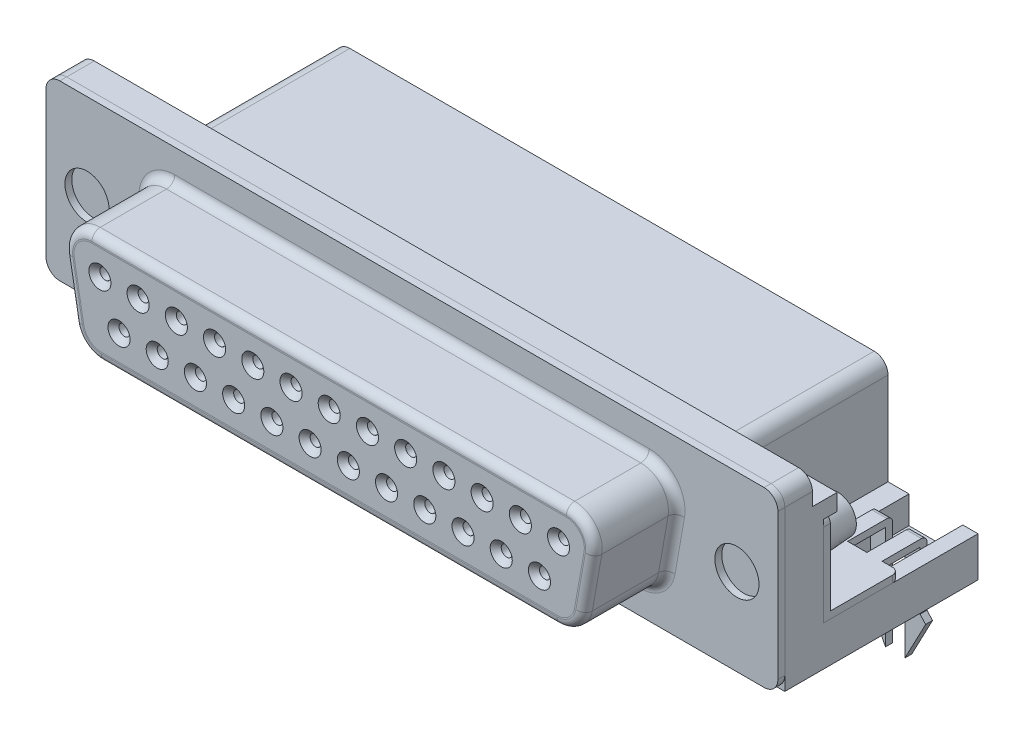
from build123d import *

# Parameters (mm, degrees)
EXTRUIR1_DEPTH         = 0.5
EXTRUIR2_DEPTH         = 6
CORTAR_EXTRUIR1_DEPTH  = 6
REDONDEO1_R            = 0.6
CROQUIS5_R             = 0.4
EXTRUIR3_DEPTH         = 6
CHAFL_N1_SIZE          = 0.4
CROQUIS6_R             = 1.6
CORTAR_EXTRUIR2_DEPTH  = 6
EXTRUIR5_DEPTH         = 14
CORTAR_EXTRUIR4_DEPTH  = 12
REDONDEO2_R            = 1
EXTRUIR6_DEPTH         = 53.04
CROQUIS13_W            = 3.9
CROQUIS13_H            = 13.996987952
CORTAR_EXTRUIR5_DEPTH  = 2
CROQUIS14_W            = 39.5
CROQUIS14_H            = 13.668273092
CORTAR_EXTRUIR6_DEPTH  = 0.6
EXTRUIR7_DEPTH         = 4.4
EXTRUIR7_DEPTH_BACK    = 2
CROQUIS15_W            = 0.7
CROQUIS15_H            = 0.7
EXTRUIR7_2_DEPTH       = 4.4
EXTRUIR7_2_DEPTH_BACK  = 2
EXTRUIR7_3_DEPTH       = 4.4
EXTRUIR7_3_DEPTH_BACK  = 2
EXTRUIR7_4_DEPTH       = 4.4
EXTRUIR7_4_DEPTH_BACK  = 2
EXTRUIR7_5_DEPTH       = 4.4
EXTRUIR7_5_DEPTH_BACK  = 2
EXTRUIR7_6_DEPTH       = 4.4
EXTRUIR7_6_DEPTH_BACK  = 2
EXTRUIR7_7_DEPTH       = 4.4
EXTRUIR7_7_DEPTH_BACK  = 2
EXTRUIR7_8_DEPTH       = 4.4
EXTRUIR7_8_DEPTH_BACK  = 2
EXTRUIR7_9_DEPTH       = 4.4
EXTRUIR7_9_DEPTH_BACK  = 2
EXTRUIR7_10_DEPTH      = 4.4
EXTRUIR7_10_DEPTH_BACK = 2
EXTRUIR7_11_DEPTH      = 4.4
EXTRUIR7_11_DEPTH_BACK = 2
EXTRUIR7_12_DEPTH      = 4.4
EXTRUIR7_12_DEPTH_BACK = 2
EXTRUIR7_13_DEPTH      = 4.4
EXTRUIR7_13_DEPTH_BACK = 2
EXTRUIR7_14_DEPTH      = 4.4
EXTRUIR7_14_DEPTH_BACK = 2
EXTRUIR7_15_DEPTH      = 4.4
EXTRUIR7_15_DEPTH_BACK = 2
EXTRUIR7_16_DEPTH      = 4.4
EXTRUIR7_16_DEPTH_BACK = 2
EXTRUIR7_17_DEPTH      = 4.4
EXTRUIR7_17_DEPTH_BACK = 2
EXTRUIR7_18_DEPTH      = 4.4
EXTRUIR7_18_DEPTH_BACK = 2
EXTRUIR7_19_DEPTH      = 4.4
EXTRUIR7_19_DEPTH_BACK = 2
EXTRUIR7_20_DEPTH      = 4.4
EXTRUIR7_20_DEPTH_BACK = 2
EXTRUIR7_21_DEPTH      = 4.4
EXTRUIR7_21_DEPTH_BACK = 2
EXTRUIR7_22_DEPTH      = 4.4
EXTRUIR7_22_DEPTH_BACK = 2
EXTRUIR7_23_DEPTH      = 4.4
EXTRUIR7_23_DEPTH_BACK = 2
EXTRUIR7_24_DEPTH      = 4.4
EXTRUIR7_24_DEPTH_BACK = 2
EXTRUIR7_25_DEPTH      = 4.4
EXTRUIR7_25_DEPTH_BACK = 2
CROQUIS16_W            = 0.7
CROQUIS16_H            = 4.035508996
CROQUIS16_H_2          = 6.875508996
CORTAR_EXTRUIR7_DEPTH  = 2
CORTAR_EXTRUIR9_DEPTH  = 4
EXTRUIR8_DEPTH         = 0.5
CROQUIS19_W            = 1.1
CROQUIS19_H            = 3.25
EXTRUIR9_DEPTH         = 0.5
REDONDEO3_R            = 0.4
EXTRUIR10_DEPTH        = 0.5
EXTRUIR10_2_DEPTH      = 0.5
REDONDEO4_R            = 0.4
CROQUIS21_R            = 1.6
EXTRUIR11_DEPTH        = 3.5
EXTRUIR11_TAPER        = 4
CROQUIS22_W            = 37
CROQUIS22_H            = 6
CROQUIS22_W_2          = 36.8
CROQUIS22_H_2          = 5.8
CORTAR_EXTRUIR10_DEPTH = 6.5


with BuildPart() as part:
    # Croquis1 → Extruir1 (new body)
    with BuildSketch(Plane.XY):
        with BuildLine():
            Line((-25.52, 6.275), (25.52, 6.275))
            ThreePointArc((25.52, 6.275), (26.227106781, 5.982106781), (26.52, 5.275))
            Line((26.52, 5.275), (26.52, -5.275))
            ThreePointArc((26.52, -5.275), (26.227106781, -5.982106781), (25.52, -6.275))
            Line((25.52, -6.275), (-25.52, -6.275))
            ThreePointArc((-25.52, -6.275), (-26.227106781, -5.982106781), (-26.52, -5.275))
            Line((-26.52, -5.275), (-26.52, 5.275))
            ThreePointArc((-26.52, 5.275), (-26.227106781, 5.982106781), (-25.52, 6.275))
        make_face()
    extrude(amount=EXTRUIR1_DEPTH)

    # Croquis2 → Extruir2 (add)
    with BuildSketch(Plane.XY.offset(0.5)):
        with BuildLine():
            Line((19.159615506, 1.602703645), (18.471940281, -2.297296355))
            ThreePointArc((18.471940281, -2.297296355), (17.787899995, -3.482088886), (16.502324775, -3.95))
            Line((16.502324775, -3.95), (-16.502324775, -3.95))
            ThreePointArc((-16.502324775, -3.95), (-17.787899995, -3.482088886), (-18.471940281, -2.297296355))
            Line((-18.471940281, -2.297296355), (-19.159615506, 1.602703645))
            ThreePointArc((-19.159615506, 1.602703645), (-18.722088886, 3.235575219), (-17.19, 3.95))
            Line((-17.19, 3.95), (17.19, 3.95))
            ThreePointArc((17.19, 3.95), (18.722088886, 3.235575219), (19.159615506, 1.602703645))
        make_face()
    extrude(amount=EXTRUIR2_DEPTH)

    # Croquis3 → Cortar-Extruir1 (cut)
    with BuildSketch(Plane.XY.offset(6.5)):
        with BuildLine():
            Line((17.19, 3.25), (-17.19, 3.25))
            ThreePointArc((-17.19, 3.25), (-18.185857776, 2.785623893), (-18.470250079, 1.724257369))
            Line((-18.470250079, 1.724257369), (-17.782574854, -2.175742631))
            ThreePointArc((-17.782574854, -2.175742631), (-17.337948668, -2.945857776), (-16.502324775, -3.25))
            Line((-16.502324775, -3.25), (16.502324775, -3.25))
            ThreePointArc((16.502324775, -3.25), (17.337948668, -2.945857776), (17.782574854, -2.175742631))
            Line((17.782574854, -2.175742631), (18.470250079, 1.724257369))
            ThreePointArc((18.470250079, 1.724257369), (18.185857776, 2.785623893), (17.19, 3.25))
        make_face()
    extrude(amount=-CORTAR_EXTRUIR1_DEPTH, mode=Mode.SUBTRACT)

    # Redondeo1
    redondeo1_edges = [part.edges().sort_by_distance(p)[0] for p in [
        (17.787899995, -3.482088886, 0.5),
        (18.815777894, -0.347296355, 0.5),
        (18.722088886, 3.235575219, 0.5),
        (0, 3.95, 0.5),
        (-18.722088886, 3.235575219, 0.5),
        (-18.815777894, -0.347296355, 0.5),
        (-17.787899995, -3.482088886, 0.5),
        (0, -3.95, 0.5),
        (17.787899995, -3.482088886, 6.5),
        (18.815777894, -0.347296355, 6.5),
        (18.722088886, 3.235575219, 6.5),
        (0, 3.95, 6.5),
        (-18.722088886, 3.235575219, 6.5),
        (-18.815777894, -0.347296355, 6.5),
        (-17.787899995, -3.482088886, 6.5),
        (0, -3.95, 6.5),
    ]]
    fillet(redondeo1_edges, radius=REDONDEO1_R)

    # Croquis6 → Cortar-Extruir2 (cut)
    with BuildSketch(Plane.XY.offset(0.5)):
        with Locations((23.55, 0)):
            Circle(CROQUIS6_R)
        with Locations((-23.55, 0)):
            Circle(CROQUIS6_R)
    extrude(amount=-CORTAR_EXTRUIR2_DEPTH, mode=Mode.SUBTRACT)


with BuildPart() as body_2:
    # Croquis5 → Extruir3 (new body)
    with BuildSketch(Plane.XY.offset(0.5)):
        with BuildLine():
            Line((17.19, 3.25), (-17.19, 3.25))
            ThreePointArc((-17.19, 3.25), (-18.185857776, 2.785623893), (-18.470250079, 1.724257369))
            Line((-18.470250079, 1.724257369), (-17.782574854, -2.175742631))
            ThreePointArc((-17.782574854, -2.175742631), (-17.337948668, -2.945857776), (-16.502324775, -3.25))
            Line((-16.502324775, -3.25), (16.502324775, -3.25))
            ThreePointArc((16.502324775, -3.25), (17.337948668, -2.945857776), (17.782574854, -2.175742631))
            Line((17.782574854, -2.175742631), (18.470250079, 1.724257369))
            ThreePointArc((18.470250079, 1.724257369), (18.185857776, 2.785623893), (17.19, 3.25))
        make_face()
        with Locations((16.625, 1.42)):
            Circle(CROQUIS5_R, mode=Mode.SUBTRACT)
        with Locations((13.855, 1.42)):
            Circle(CROQUIS5_R, mode=Mode.SUBTRACT)
        with Locations((11.085, 1.42)):
            Circle(CROQUIS5_R, mode=Mode.SUBTRACT)
        with Locations((8.315, 1.42)):
            Circle(CROQUIS5_R, mode=Mode.SUBTRACT)
        with Locations((5.545, 1.42)):
            Circle(CROQUIS5_R, mode=Mode.SUBTRACT)
        with Locations((2.775, 1.42)):
            Circle(CROQUIS5_R, mode=Mode.SUBTRACT)
        with Locations((0.005, 1.42)):
            Circle(CROQUIS5_R, mode=Mode.SUBTRACT)
        with Locations((-2.765, 1.42)):
            Circle(CROQUIS5_R, mode=Mode.SUBTRACT)
        with Locations((-5.535, 1.42)):
            Circle(CROQUIS5_R, mode=Mode.SUBTRACT)
        with Locations((-8.305, 1.42)):
            Circle(CROQUIS5_R, mode=Mode.SUBTRACT)
        with Locations((-11.075, 1.42)):
            Circle(CROQUIS5_R, mode=Mode.SUBTRACT)
        with Locations((-13.845, 1.42)):
            Circle(CROQUIS5_R, mode=Mode.SUBTRACT)
        with Locations((-16.615, 1.42)):
            Circle(CROQUIS5_R, mode=Mode.SUBTRACT)
        with Locations((15.24, -1.42)):
            Circle(CROQUIS5_R, mode=Mode.SUBTRACT)
        with Locations((12.47, -1.42)):
            Circle(CROQUIS5_R, mode=Mode.SUBTRACT)
        with Locations((9.7, -1.42)):
            Circle(CROQUIS5_R, mode=Mode.SUBTRACT)
        with Locations((6.93, -1.42)):
            Circle(CROQUIS5_R, mode=Mode.SUBTRACT)
        with Locations((4.16, -1.42)):
            Circle(CROQUIS5_R, mode=Mode.SUBTRACT)
        with Locations((1.39, -1.42)):
            Circle(CROQUIS5_R, mode=Mode.SUBTRACT)
        with Locations((-1.38, -1.42)):
            Circle(CROQUIS5_R, mode=Mode.SUBTRACT)
        with Locations((-4.15, -1.42)):
            Circle(CROQUIS5_R, mode=Mode.SUBTRACT)
        with Locations((-6.92, -1.42)):
            Circle(CROQUIS5_R, mode=Mode.SUBTRACT)
        with Locations((-9.69, -1.42)):
            Circle(CROQUIS5_R, mode=Mode.SUBTRACT)
        with Locations((-12.46, -1.42)):
            Circle(CROQUIS5_R, mode=Mode.SUBTRACT)
        with Locations((-15.23, -1.42)):
            Circle(CROQUIS5_R, mode=Mode.SUBTRACT)
    extrude(amount=EXTRUIR3_DEPTH)

    # Chaflán1
    chafl_n1_edges = [body_2.edges().sort_by_distance(p)[0] for p in [
        (-7.32, -1.42, 6.5),
        (-10.09, -1.42, 6.5),
        (-12.86, -1.42, 6.5),
        (-15.63, -1.42, 6.5),
        (16.225, 1.42, 6.5),
        (13.455, 1.42, 6.5),
        (10.685, 1.42, 6.5),
        (7.915, 1.42, 6.5),
        (5.145, 1.42, 6.5),
        (2.375, 1.42, 6.5),
        (-0.395, 1.42, 6.5),
        (-3.165, 1.42, 6.5),
        (-5.935, 1.42, 6.5),
        (-8.705, 1.42, 6.5),
        (-11.475, 1.42, 6.5),
        (-14.245, 1.42, 6.5),
        (-17.015, 1.42, 6.5),
        (14.84, -1.42, 6.5),
        (12.07, -1.42, 6.5),
        (9.3, -1.42, 6.5),
        (6.53, -1.42, 6.5),
        (3.76, -1.42, 6.5),
        (0.99, -1.42, 6.5),
        (-1.78, -1.42, 6.5),
        (-4.55, -1.42, 6.5),
    ]]
    chamfer(chafl_n1_edges, length=CHAFL_N1_SIZE)


with BuildPart() as body_3:
    # Croquis10 → Extruir5 (new body)
    with BuildSketch(Plane(origin=(0, 0, 0), x_dir=(-1, 0, 0), z_dir=(0, 0, -1))):
        with BuildLine():
            Line((-25.52, 6.275), (25.52, 6.275))
            ThreePointArc((25.52, 6.275), (26.227106781, 5.982106781), (26.52, 5.275))
            Line((26.52, 5.275), (26.52, -6.275))
            Line((26.52, -6.275), (-26.52, -6.275))
            Line((-26.52, -6.275), (-26.52, 5.275))
            ThreePointArc((-26.52, 5.275), (-26.227106781, 5.982106781), (-25.52, 6.275))
        make_face()
    extrude(amount=EXTRUIR5_DEPTH)

    # Croquis11 → Cortar-Extruir4 (cut)
    with BuildSketch(Plane(origin=(0, 0, -14), x_dir=(-1, 0, 0), z_dir=(0, 0, -1))):
        Polygon((30.029317269, -3.375), (20, -3.375), (20, 4.325), (-20, 4.325), (-20, -3.375), (-30.65060241, -3.375), (-30.65060241, 10.825803213), (30.029317269, 10.825803213), align=None)
    extrude(amount=-CORTAR_EXTRUIR4_DEPTH, mode=Mode.SUBTRACT)

    # Redondeo2
    redondeo2_edges = [body_3.edges().sort_by_distance(p)[0] for p in [
        (-20, 4.325, -8),
        (20, 4.325, -8),
    ]]
    fillet(redondeo2_edges, radius=REDONDEO2_R)


with BuildPart() as body_4:
    # Croquis12 → Extruir6 (new body)
    with BuildSketch(Plane(origin=(26.52, 0, 0), x_dir=(0, 0, -1), z_dir=(1, 0, 0))):
        Polygon((2, 4.325), (3.8, 4.325), (3.8, 3.125), (2.8, 3.125), (2.8, -3.375), (2, -3.375), align=None)
    extrude(amount=-EXTRUIR6_DEPTH)


with BuildPart() as body_3_1:
    add(body_3.part)

    # Combinar1: union body 4
    add(body_4.part)

    # Croquis13 → Cortar-Extruir5 (cut)
    with BuildSketch(Plane(origin=(0, -3.375, 0), x_dir=(-1, 0, 0), z_dir=(0, 1, 0))):
        with Locations((-23.47, -9.798493976)):
            Rectangle(CROQUIS13_W, CROQUIS13_H)
        with Locations((23.47, -9.798493976)):
            Rectangle(CROQUIS13_W, CROQUIS13_H)
    extrude(amount=-CORTAR_EXTRUIR5_DEPTH, mode=Mode.SUBTRACT)

    # Croquis14 → Cortar-Extruir6 (cut)
    with BuildSketch(Plane.XZ.offset(6.275)):
        with Locations((0, -8.834136546)):
            Rectangle(CROQUIS14_W, CROQUIS14_H)
    extrude(amount=-CORTAR_EXTRUIR6_DEPTH, mode=Mode.SUBTRACT)

    # Croquis16 → Cortar-Extruir7 (cut)
    with BuildSketch(Plane.XZ.offset(5.675)):
        with Locations((16.625, -14.017754498)):
            Rectangle(CROQUIS16_W, CROQUIS16_H)
        with Locations((13.855, -14.017754498)):
            Rectangle(CROQUIS16_W, CROQUIS16_H)
        with Locations((15.24, -12.597754498)):
            Rectangle(CROQUIS16_W, CROQUIS16_H_2)
        with Locations((12.47, -12.597754498)):
            Rectangle(CROQUIS16_W, CROQUIS16_H_2)
        with Locations((11.085, -14.017754498)):
            Rectangle(CROQUIS16_W, CROQUIS16_H)
        with Locations((9.7, -12.597754498)):
            Rectangle(CROQUIS16_W, CROQUIS16_H_2)
        with Locations((8.315, -14.017754498)):
            Rectangle(CROQUIS16_W, CROQUIS16_H)
        with Locations((6.93, -12.597754498)):
            Rectangle(CROQUIS16_W, CROQUIS16_H_2)
        with Locations((5.545, -14.017754498)):
            Rectangle(CROQUIS16_W, CROQUIS16_H)
        with Locations((4.16, -12.597754498)):
            Rectangle(CROQUIS16_W, CROQUIS16_H_2)
        with Locations((2.775, -14.017754498)):
            Rectangle(CROQUIS16_W, CROQUIS16_H)
        with Locations((1.39, -12.597754498)):
            Rectangle(CROQUIS16_W, CROQUIS16_H_2)
        with Locations((0.005, -14.017754498)):
            Rectangle(CROQUIS16_W, CROQUIS16_H)
        with Locations((-1.38, -12.597754498)):
            Rectangle(CROQUIS16_W, CROQUIS16_H_2)
        with Locations((-2.765, -14.017754498)):
            Rectangle(CROQUIS16_W, CROQUIS16_H)
        with Locations((-4.15, -12.597754498)):
            Rectangle(CROQUIS16_W, CROQUIS16_H_2)
        with Locations((-5.535, -14.017754498)):
            Rectangle(CROQUIS16_W, CROQUIS16_H)
        with Locations((-6.92, -12.597754498)):
            Rectangle(CROQUIS16_W, CROQUIS16_H_2)
        with Locations((-8.305, -14.017754498)):
            Rectangle(CROQUIS16_W, CROQUIS16_H)
        with Locations((-9.69, -12.597754498)):
            Rectangle(CROQUIS16_W, CROQUIS16_H_2)
        with Locations((-11.075, -14.017754498)):
            Rectangle(CROQUIS16_W, CROQUIS16_H)
        with Locations((-12.46, -12.597754498)):
            Rectangle(CROQUIS16_W, CROQUIS16_H_2)
        with Locations((-13.845, -14.017754498)):
            Rectangle(CROQUIS16_W, CROQUIS16_H)
        with Locations((-15.23, -12.597754498)):
            Rectangle(CROQUIS16_W, CROQUIS16_H_2)
        with Locations((-16.615, -14.017754498)):
            Rectangle(CROQUIS16_W, CROQUIS16_H)
    extrude(amount=-CORTAR_EXTRUIR7_DEPTH, mode=Mode.SUBTRACT)

    # Croquis17 → Cortar-Extruir9 (cut)
    with BuildSketch(Plane(origin=(0, -5.375, 0), x_dir=(-1, 0, 0), z_dir=(0, 1, 0))):
        with BuildLine():
            Line((-21.52, -9.3), (-21.52, -11.3))
            ThreePointArc((-21.52, -11.3), (-23.47, -13.25), (-25.42, -11.3))
            Line((-25.42, -11.3), (-25.42, -9.3))
            ThreePointArc((-25.42, -9.3), (-23.47, -7.35), (-21.52, -9.3))
        make_face()
        with BuildLine():
            Line((25.42, -9.3), (25.42, -11.3))
            ThreePointArc((25.42, -11.3), (23.47, -13.25), (21.52, -11.3))
            Line((21.52, -11.3), (21.52, -9.3))
            ThreePointArc((21.52, -9.3), (23.47, -7.35), (25.42, -9.3))
        make_face()
    extrude(amount=-CORTAR_EXTRUIR9_DEPTH, mode=Mode.SUBTRACT)

    # Redondeo3
    redondeo3_edges = [body_3_1.edges().sort_by_distance(p)[0] for p in [
        (25.97, -3.375, -2.8),
    ]]
    fillet(redondeo3_edges, radius=REDONDEO3_R)

    # Croquis22 → Cortar-Extruir10 (cut)
    with BuildSketch(Plane(origin=(0, 0, -14), x_dir=(-1, 0, 0), z_dir=(0, 0, -1))):
        with Locations((0, -0.675)):
            Rectangle(CROQUIS22_W, CROQUIS22_H)
        with Locations((0, -0.675)):
            Rectangle(CROQUIS22_W_2, CROQUIS22_H_2, mode=Mode.SUBTRACT)
    extrude(amount=-CORTAR_EXTRUIR10_DEPTH, mode=Mode.SUBTRACT)


with BuildPart() as body_4_2:
    # Croquis15 → Extruir7 (new, two sides: drawn at the far end of the back side and taken through both)
    with BuildSketch(Plane.XZ.offset(5.675).offset(-EXTRUIR7_DEPTH_BACK)):
        with Locations((16.625, -12.35)):
            Rectangle(CROQUIS15_W, CROQUIS15_H)
    extrude(amount=EXTRUIR7_DEPTH + EXTRUIR7_DEPTH_BACK)


with BuildPart() as body_5:
    # Croquis15 → Extruir7 2 (new, two sides: drawn at the far end of the back side and taken through both)
    with BuildSketch(Plane.XZ.offset(5.675).offset(-EXTRUIR7_2_DEPTH_BACK)):
        with Locations((13.855, -12.35)):
            Rectangle(CROQUIS15_W, CROQUIS15_H)
    extrude(amount=EXTRUIR7_2_DEPTH + EXTRUIR7_2_DEPTH_BACK)


with BuildPart() as body_6:
    # Croquis15 → Extruir7 3 (new, two sides: drawn at the far end of the back side and taken through both)
    with BuildSketch(Plane.XZ.offset(5.675).offset(-EXTRUIR7_3_DEPTH_BACK)):
        with Locations((11.085, -12.35)):
            Rectangle(CROQUIS15_W, CROQUIS15_H)
    extrude(amount=EXTRUIR7_3_DEPTH + EXTRUIR7_3_DEPTH_BACK)


with BuildPart() as body_7:
    # Croquis15 → Extruir7 4 (new, two sides: drawn at the far end of the back side and taken through both)
    with BuildSketch(Plane.XZ.offset(5.675).offset(-EXTRUIR7_4_DEPTH_BACK)):
        with Locations((8.315, -12.35)):
            Rectangle(CROQUIS15_W, CROQUIS15_H)
    extrude(amount=EXTRUIR7_4_DEPTH + EXTRUIR7_4_DEPTH_BACK)


with BuildPart() as body_8:
    # Croquis15 → Extruir7 5 (new, two sides: drawn at the far end of the back side and taken through both)
    with BuildSketch(Plane.XZ.offset(5.675).offset(-EXTRUIR7_5_DEPTH_BACK)):
        with Locations((5.545, -12.35)):
            Rectangle(CROQUIS15_W, CROQUIS15_H)
    extrude(amount=EXTRUIR7_5_DEPTH + EXTRUIR7_5_DEPTH_BACK)


with BuildPart() as body_9:
    # Croquis15 → Extruir7 6 (new, two sides: drawn at the far end of the back side and taken through both)
    with BuildSketch(Plane.XZ.offset(5.675).offset(-EXTRUIR7_6_DEPTH_BACK)):
        with Locations((2.775, -12.35)):
            Rectangle(CROQUIS15_W, CROQUIS15_H)
    extrude(amount=EXTRUIR7_6_DEPTH + EXTRUIR7_6_DEPTH_BACK)


with BuildPart() as body_10:
    # Croquis15 → Extruir7 7 (new, two sides: drawn at the far end of the back side and taken through both)
    with BuildSketch(Plane.XZ.offset(5.675).offset(-EXTRUIR7_7_DEPTH_BACK)):
        with Locations((0.005, -12.35)):
            Rectangle(CROQUIS15_W, CROQUIS15_H)
    extrude(amount=EXTRUIR7_7_DEPTH + EXTRUIR7_7_DEPTH_BACK)


with BuildPart() as body_11:
    # Croquis15 → Extruir7 8 (new, two sides: drawn at the far end of the back side and taken through both)
    with BuildSketch(Plane.XZ.offset(5.675).offset(-EXTRUIR7_8_DEPTH_BACK)):
        with Locations((-2.765, -12.35)):
            Rectangle(CROQUIS15_W, CROQUIS15_H)
    extrude(amount=EXTRUIR7_8_DEPTH + EXTRUIR7_8_DEPTH_BACK)


with BuildPart() as body_12:
    # Croquis15 → Extruir7 9 (new, two sides: drawn at the far end of the back side and taken through both)
    with BuildSketch(Plane.XZ.offset(5.675).offset(-EXTRUIR7_9_DEPTH_BACK)):
        with Locations((-5.535, -12.35)):
            Rectangle(CROQUIS15_W, CROQUIS15_H)
    extrude(amount=EXTRUIR7_9_DEPTH + EXTRUIR7_9_DEPTH_BACK)


with BuildPart() as body_13:
    # Croquis15 → Extruir7 10 (new, two sides: drawn at the far end of the back side and taken through both)
    with BuildSketch(Plane.XZ.offset(5.675).offset(-EXTRUIR7_10_DEPTH_BACK)):
        with Locations((-8.305, -12.35)):
            Rectangle(CROQUIS15_W, CROQUIS15_H)
    extrude(amount=EXTRUIR7_10_DEPTH + EXTRUIR7_10_DEPTH_BACK)


with BuildPart() as body_14:
    # Croquis15 → Extruir7 11 (new, two sides: drawn at the far end of the back side and taken through both)
    with BuildSketch(Plane.XZ.offset(5.675).offset(-EXTRUIR7_11_DEPTH_BACK)):
        with Locations((-11.075, -12.35)):
            Rectangle(CROQUIS15_W, CROQUIS15_H)
    extrude(amount=EXTRUIR7_11_DEPTH + EXTRUIR7_11_DEPTH_BACK)


with BuildPart() as body_15:
    # Croquis15 → Extruir7 12 (new, two sides: drawn at the far end of the back side and taken through both)
    with BuildSketch(Plane.XZ.offset(5.675).offset(-EXTRUIR7_12_DEPTH_BACK)):
        with Locations((-13.845, -12.35)):
            Rectangle(CROQUIS15_W, CROQUIS15_H)
    extrude(amount=EXTRUIR7_12_DEPTH + EXTRUIR7_12_DEPTH_BACK)


with BuildPart() as body_16:
    # Croquis15 → Extruir7 13 (new, two sides: drawn at the far end of the back side and taken through both)
    with BuildSketch(Plane.XZ.offset(5.675).offset(-EXTRUIR7_13_DEPTH_BACK)):
        with Locations((-16.615, -12.35)):
            Rectangle(CROQUIS15_W, CROQUIS15_H)
    extrude(amount=EXTRUIR7_13_DEPTH + EXTRUIR7_13_DEPTH_BACK)


with BuildPart() as body_17:
    # Croquis15 → Extruir7 14 (new, two sides: drawn at the far end of the back side and taken through both)
    with BuildSketch(Plane.XZ.offset(5.675).offset(-EXTRUIR7_14_DEPTH_BACK)):
        with Locations((15.24, -9.51)):
            Rectangle(CROQUIS15_W, CROQUIS15_H)
    extrude(amount=EXTRUIR7_14_DEPTH + EXTRUIR7_14_DEPTH_BACK)


with BuildPart() as body_18:
    # Croquis15 → Extruir7 15 (new, two sides: drawn at the far end of the back side and taken through both)
    with BuildSketch(Plane.XZ.offset(5.675).offset(-EXTRUIR7_15_DEPTH_BACK)):
        with Locations((12.47, -9.51)):
            Rectangle(CROQUIS15_W, CROQUIS15_H)
    extrude(amount=EXTRUIR7_15_DEPTH + EXTRUIR7_15_DEPTH_BACK)


with BuildPart() as body_19:
    # Croquis15 → Extruir7 16 (new, two sides: drawn at the far end of the back side and taken through both)
    with BuildSketch(Plane.XZ.offset(5.675).offset(-EXTRUIR7_16_DEPTH_BACK)):
        with Locations((9.7, -9.51)):
            Rectangle(CROQUIS15_W, CROQUIS15_H)
    extrude(amount=EXTRUIR7_16_DEPTH + EXTRUIR7_16_DEPTH_BACK)


with BuildPart() as body_20:
    # Croquis15 → Extruir7 17 (new, two sides: drawn at the far end of the back side and taken through both)
    with BuildSketch(Plane.XZ.offset(5.675).offset(-EXTRUIR7_17_DEPTH_BACK)):
        with Locations((6.93, -9.51)):
            Rectangle(CROQUIS15_W, CROQUIS15_H)
    extrude(amount=EXTRUIR7_17_DEPTH + EXTRUIR7_17_DEPTH_BACK)


with BuildPart() as body_21:
    # Croquis15 → Extruir7 18 (new, two sides: drawn at the far end of the back side and taken through both)
    with BuildSketch(Plane.XZ.offset(5.675).offset(-EXTRUIR7_18_DEPTH_BACK)):
        with Locations((4.16, -9.51)):
            Rectangle(CROQUIS15_W, CROQUIS15_H)
    extrude(amount=EXTRUIR7_18_DEPTH + EXTRUIR7_18_DEPTH_BACK)


with BuildPart() as body_22:
    # Croquis15 → Extruir7 19 (new, two sides: drawn at the far end of the back side and taken through both)
    with BuildSketch(Plane.XZ.offset(5.675).offset(-EXTRUIR7_19_DEPTH_BACK)):
        with Locations((1.39, -9.51)):
            Rectangle(CROQUIS15_W, CROQUIS15_H)
    extrude(amount=EXTRUIR7_19_DEPTH + EXTRUIR7_19_DEPTH_BACK)


with BuildPart() as body_23:
    # Croquis15 → Extruir7 20 (new, two sides: drawn at the far end of the back side and taken through both)
    with BuildSketch(Plane.XZ.offset(5.675).offset(-EXTRUIR7_20_DEPTH_BACK)):
        with Locations((-1.38, -9.51)):
            Rectangle(CROQUIS15_W, CROQUIS15_H)
    extrude(amount=EXTRUIR7_20_DEPTH + EXTRUIR7_20_DEPTH_BACK)


with BuildPart() as body_24:
    # Croquis15 → Extruir7 21 (new, two sides: drawn at the far end of the back side and taken through both)
    with BuildSketch(Plane.XZ.offset(5.675).offset(-EXTRUIR7_21_DEPTH_BACK)):
        with Locations((-4.15, -9.51)):
            Rectangle(CROQUIS15_W, CROQUIS15_H)
    extrude(amount=EXTRUIR7_21_DEPTH + EXTRUIR7_21_DEPTH_BACK)


with BuildPart() as body_25:
    # Croquis15 → Extruir7 22 (new, two sides: drawn at the far end of the back side and taken through both)
    with BuildSketch(Plane.XZ.offset(5.675).offset(-EXTRUIR7_22_DEPTH_BACK)):
        with Locations((-6.92, -9.51)):
            Rectangle(CROQUIS15_W, CROQUIS15_H)
    extrude(amount=EXTRUIR7_22_DEPTH + EXTRUIR7_22_DEPTH_BACK)


with BuildPart() as body_26:
    # Croquis15 → Extruir7 23 (new, two sides: drawn at the far end of the back side and taken through both)
    with BuildSketch(Plane.XZ.offset(5.675).offset(-EXTRUIR7_23_DEPTH_BACK)):
        with Locations((-9.69, -9.51)):
            Rectangle(CROQUIS15_W, CROQUIS15_H)
    extrude(amount=EXTRUIR7_23_DEPTH + EXTRUIR7_23_DEPTH_BACK)


with BuildPart() as body_27:
    # Croquis15 → Extruir7 24 (new, two sides: drawn at the far end of the back side and taken through both)
    with BuildSketch(Plane.XZ.offset(5.675).offset(-EXTRUIR7_24_DEPTH_BACK)):
        with Locations((-12.46, -9.51)):
            Rectangle(CROQUIS15_W, CROQUIS15_H)
    extrude(amount=EXTRUIR7_24_DEPTH + EXTRUIR7_24_DEPTH_BACK)


with BuildPart() as body_28:
    # Croquis15 → Extruir7 25 (new, two sides: drawn at the far end of the back side and taken through both)
    with BuildSketch(Plane.XZ.offset(5.675).offset(-EXTRUIR7_25_DEPTH_BACK)):
        with Locations((-15.23, -9.51)):
            Rectangle(CROQUIS15_W, CROQUIS15_H)
    extrude(amount=EXTRUIR7_25_DEPTH + EXTRUIR7_25_DEPTH_BACK)


with BuildPart() as body_29:
    # Croquis18 → Extruir8 (new body)
    with BuildSketch(Plane(origin=(0, 0, -2.8), x_dir=(-1, 0, 0), z_dir=(0, 0, -1))):
        with BuildLine():
            Line((-26.02, 3.125), (-21.022352261, 3.125))
            ThreePointArc((-21.022352261, 3.125), (-20.66879887, 2.978553391), (-20.522352261, 2.625))
            Line((-20.522352261, 2.625), (-20.522352261, -3.375))
            Line((-20.522352261, -3.375), (-26.52, -3.375))
            Line((-26.52, -3.375), (-26.52, 2.625))
            ThreePointArc((-26.52, 2.625), (-26.373553391, 2.978553391), (-26.02, 3.125))
        make_face()
    extrude(amount=EXTRUIR8_DEPTH)


with BuildPart() as body_30:
    # Croquis19 → Extruir9 (new body)
    with BuildSketch(Plane(origin=(0, -3.375, 0), x_dir=(-1, 0, 0), z_dir=(0, 1, 0))):
        with BuildLine():
            Line((-20.522352261, -7.8), (-20.522352261, -3.3))
            Line((-20.522352261, -3.3), (-25.42, -3.3))
            Line((-25.42, -3.3), (-25.42, -8.3))
            Line((-25.42, -8.3), (-25.27, -8.3))
            Line((-25.27, -8.3), (-25.27, -11.55))
            Line((-25.27, -11.55), (-24.17, -11.55))
            Line((-24.17, -11.55), (-24.17, -8.3))
            Line((-24.17, -8.3), (-22.77, -8.3))
            Line((-22.77, -8.3), (-21.67, -8.3))
            Line((-21.67, -8.3), (-21.022352261, -8.3))
            ThreePointArc((-21.022352261, -8.3), (-20.66879887, -8.153553391), (-20.522352261, -7.8))
        make_face()
        with BuildLine():
            Line((-25.42, -8.3), (-25.42, -3.3))
            Line((-25.42, -3.3), (-26.52, -3.3))
            Line((-26.52, -3.3), (-26.52, -7.8))
            ThreePointArc((-26.52, -7.8), (-26.373553391, -8.153553391), (-26.02, -8.3))
            Line((-26.02, -8.3), (-25.42, -8.3))
        make_face()
        with Locations((-22.22, -9.925)):
            Rectangle(CROQUIS19_W, CROQUIS19_H)
    extrude(amount=EXTRUIR9_DEPTH)


with BuildPart() as body_29_1:
    add(body_29.part)

    # Combinar2: union body 30
    add(body_30.part)


with BuildPart() as body_30_2:
    # Croquis20 → Extruir10 (new body)
    with BuildSketch(Plane(origin=(0, 0, -11.55), x_dir=(-1, 0, 0), z_dir=(0, 0, -1))):
        Polygon((-25.27, -3.375), (-25.27, -7.572082934), (-25.677453859, -8.013039481), (-24.17, -10.875), (-24.17, -3.375), align=None)
    extrude(amount=-EXTRUIR10_DEPTH)


with BuildPart() as body_31:
    # Croquis20 → Extruir10 2 (new body)
    with BuildSketch(Plane(origin=(0, 0, -11.55), x_dir=(-1, 0, 0), z_dir=(0, 0, -1))):
        Polygon((-22.77, -3.375), (-21.67, -3.375), (-21.67, -7.572082934), (-21.262546141, -8.013039481), (-22.77, -10.875), align=None)
    extrude(amount=-EXTRUIR10_2_DEPTH)


with BuildPart() as body_30_2_1:
    add(body_30_2.part)

    # Combinar3: union body 31, body 29
    add(body_31.part)
    add(body_29_1.part)

    # Redondeo4
    redondeo4_edges = [body_30_2_1.edges().sort_by_distance(p)[0] for p in [
        (24.72, -2.875, -11.55),
        (22.22, -2.875, -11.55),
    ]]
    fillet(redondeo4_edges, radius=REDONDEO4_R)


with BuildPart() as body_30_3:
    # Croquis21 → Extruir11 (new body)
    with BuildSketch(Plane(origin=(0, 0, -3.3), x_dir=(-1, 0, 0), z_dir=(0, 0, -1))):
        with Locations(Location((-23.55, 0, 0), (0, 0, 180))):
            Circle(CROQUIS21_R)
    extrude(amount=EXTRUIR11_DEPTH, taper=EXTRUIR11_TAPER)


with BuildPart() as body_31_2:
    # Simetría2: mirrored copy
    add(body_30_3.part.mirror(Plane(origin=(0, 0, 0), x_dir=(0, 0, 1), z_dir=(1, 0, 0))))


with BuildPart() as body_32:
    # Simetr_a2 2: mirrored copy
    add(body_30_2_1.part.mirror(Plane(origin=(0, 0, 0), x_dir=(0, 0, 1), z_dir=(1, 0, 0))))


solid = Compound([part.part, body_2.part, body_3_1.part, body_4_2.part, body_5.part, body_6.part, body_7.part, body_8.part, body_9.part, body_10.part, body_11.part, body_12.part, body_13.part, body_14.part, body_15.part, body_16.part, body_17.part, body_18.part, body_19.part, body_20.part, body_21.part, body_22.part, body_23.part, body_24.part, body_25.part, body_26.part, body_27.part, body_28.part, body_30_2_1.part, body_30_3.part, body_31_2.part, body_32.part])
